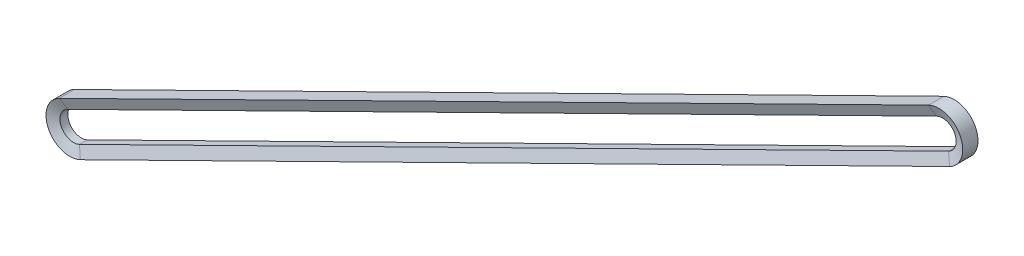
from build123d import *


with BuildPart() as part:
    # 扫描1: sweep along a path in 草图2
    with BuildLine(Plane.XY) as sweep_1_path:
        Line((2.344320341, -4.753331688), (-337.429166382, -172.327982197))
        ThreePointArc((-337.429166382, -172.327982197), (-344.526818412, -169.91897085), (-342.117807065, -162.82131882))
        Line((-342.117807065, -162.82131882), (-2.344320341, 4.753331688))
        ThreePointArc((-2.344320341, 4.753331688), (4.753331688, 2.344320341), (2.344320341, -4.753331688))
    # 草图3 → 扫描1 (sweep)
    with BuildSketch(Plane(origin=(0, 0, 0), x_dir=(0, 0, -1), z_dir=(0.8968550354896063, 0.4423245927109831, 0))):
        Polygon((-1.535, 5.3), (1.535, 5.3), (2.990880937, 9.3), (-2.990880937, 9.3), align=None)
    sweep(path=sweep_1_path.line)


solid = part.part
